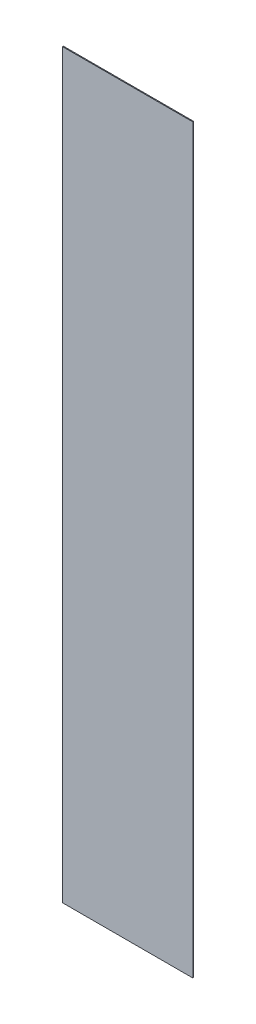
from build123d import *

# Parameters (mm, degrees)
SKETCH_1_W      = 440
SKETCH_1_H      = 2500
EXTRUDE_1_DEPTH = 3


with BuildPart() as part:
    # 草圖1 → 填料-伸長1 (new body)
    with BuildSketch(Plane.XY):
        with Locations((220, 1250)):
            Rectangle(SKETCH_1_W, SKETCH_1_H)
    extrude(amount=EXTRUDE_1_DEPTH)


solid = part.part
